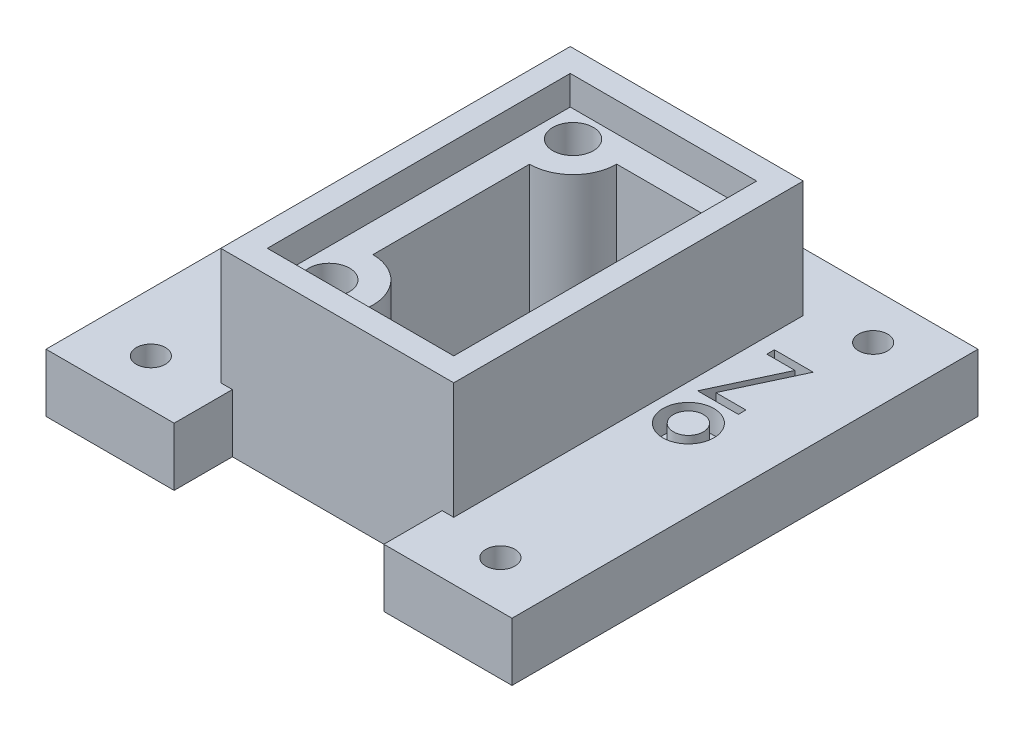
from build123d import *

# Parameters (mm, degrees)
BOSS_EXTRUDE1_DEPTH = 5
SKETCH2_W           = 20
SKETCH2_H           = 30
BOSS_EXTRUDE2_DEPTH = 10
SKETCH3_W           = 16
SKETCH3_H           = 26
CUT_EXTRUDE1_DEPTH  = 2.5
SKETCH4_R           = 1.741070667
SKETCH4_R_2         = 1.74917144
CUT_EXTRUDE2_DEPTH  = 12.5
CUT_EXTRUDE3_DEPTH  = 2.5
SKETCH10_R          = 2.187200611
SKETCH10_R_2        = 1.286018764
CUT_EXTRUDE7_DEPTH  = 2
SKETCH11_R          = 1.25
CUT_EXTRUDE8_DEPTH  = 5


with BuildPart() as part:
    # Sketch1 → Boss-Extrude1 (new body)
    with BuildSketch(Plane(origin=(0, 0, 0), x_dir=(1, 0, 0), z_dir=(0, 1, 0))):
        Polygon((-28.098710289, 18.79265625), (11.901289711, 18.79265625), (11.901289711, -21.20734375), (0.901289711, -21.20734375), (0.901289711, -16.20734375), (-17.098710289, -16.20734375), (-17.098710289, -21.20734375), (-28.098710289, -21.20734375), align=None)
    extrude(amount=BOSS_EXTRUDE1_DEPTH)

    # Sketch2 → Boss-Extrude2 (add)
    with BuildSketch(Plane(origin=(0, 5, 0), x_dir=(1, 0, 0), z_dir=(0, 1, 0))):
        with Locations((-8.098710289, -1.20734375)):
            Rectangle(SKETCH2_W, SKETCH2_H)
    extrude(amount=BOSS_EXTRUDE2_DEPTH)

    # Sketch3 → Cut-Extrude1 (cut)
    with BuildSketch(Plane(origin=(0, 15, 0), x_dir=(1, 0, 0), z_dir=(0, 1, 0))):
        with Locations((-8.098710289, -1.20734375)):
            Rectangle(SKETCH3_W, SKETCH3_H)
    extrude(amount=-CUT_EXTRUDE1_DEPTH, mode=Mode.SUBTRACT)

    # Sketch4 → Cut-Extrude2 (cut)
    with BuildSketch(Plane(origin=(0, 12.5, 0), x_dir=(1, 0, 0), z_dir=(0, 1, 0))):
        with Locations(Location((-13.598710289, 9.533726917, 0), (0, 0, 270))):
            Circle(SKETCH4_R)
        with Locations(Location((-13.598710289, -11.400038003, 0), (0, 0, 270))):
            Circle(SKETCH4_R_2)
        with BuildLine():
            Line((-9.857650278, 9.54265625), (-2.598710289, 9.54265625))
            Line((-2.598710289, 9.54265625), (-2.598710289, -11.70734375))
            Line((-2.598710289, -11.70734375), (-9.862154433, -11.70734375))
            ThreePointArc((-9.862154433, -11.70734375), (-10.841136317, -8.859945036), (-13.598710289, -7.650866563))
            Line((-13.598710289, -7.650866563), (-13.598710289, 5.79265625))
            ThreePointArc((-13.598710289, 5.79265625), (-10.950218737, 6.891549361), (-9.857650278, 9.54265625))
        make_face()
    extrude(amount=-CUT_EXTRUDE2_DEPTH, mode=Mode.SUBTRACT)

    # Sketch5 → Cut-Extrude3 (cut)
    with BuildSketch(Plane.XZ):
        Polygon((-11.013093596, 9.763602959), (-10.888707623, 12.821030221), (-13.474324315, 14.457465265), (-16.184326981, 13.036473046), (-16.308712955, 9.979045784), (-13.723096262, 8.34261074), align=None)
        Polygon((-10.5398219, -9.614567263), (-11.999256302, -6.925072038), (-15.05814469, -6.844231693), (-16.657598677, -9.452886572), (-15.198164275, -12.142381796), (-12.139275887, -12.223222142), align=None)
    extrude(amount=-CUT_EXTRUDE3_DEPTH, mode=Mode.SUBTRACT)

    # Sketch10 → Cut-Extrude7 (cut)
    # profile 1 of 6: a face of its own
    with BuildSketch(Plane(origin=(0, 5, 0), x_dir=(1, 0, 0), z_dir=(0, 1, 0))):
        with Locations(Location((4.971694187, 0.863959669, 0), (0, 0, 270))):
            Circle(SKETCH10_R)
        with Locations(Location((4.971694187, 0.863959669, 0), (0, 0, 270))):
            Circle(SKETCH10_R_2, mode=Mode.SUBTRACT)
    # profile 2 of 6: a face of its own
    with BuildSketch(Plane(origin=(0, 5, 0), x_dir=(1, 0, 0), z_dir=(0, 1, 0))):
        Polygon((-6.934780849, 18.55515625), (-6.441549178, 18.55515625), (-5.194636618, 16.607034255), (-3.947724058, 18.55515625), (-3.454492387, 18.55515625), (-4.947543769, 16.221607572), (-3.393434695, 13.79265625), (-3.886666366, 13.79265625), (-5.194636618, 15.836180889), (-6.50260687, 13.79265625), (-6.995838541, 13.79265625), (-5.44077544, 16.221607572), align=None)
    # profile 3 of 6: a face of its own
    with BuildSketch(Plane(origin=(0, 5, 0), x_dir=(1, 0, 0), z_dir=(0, 1, 0))):
        with BuildLine():
            add(Edge.make_bspline(
                [(-11.401511412, 18.039251811), (-11.391176898, 18.028213248), (-11.371535294, 18.007233539), (-11.350489172, 17.970347371), (-11.338990843, 17.930849446), (-11.340512779, 17.903871876), (-11.341271456, 17.890423686)],
                knots=[0, 0, 0, 0, 1.086383765, 2.064762959, 3.035293514, 4, 4, 4, 4], degree=3))
            add(Edge.make_bspline(
                [(-11.341271456, 17.890423686), (-11.345286126, 17.870413794), (-11.35451753, 17.824402693), (-11.407409924, 17.768867664), (-11.46486929, 17.715003045), (-11.503486765, 17.677881965), (-11.521991322, 17.660094445)],
                knots=[0, 0, 0, 0, 0.805786305, 1.852839402, 2.971132773, 4, 4, 4, 4], degree=3))
            Line((-11.521991322, 17.660094445), (-12.503548242, 16.719878671))
            Line((-12.503548242, 16.719878671), (-8.036342141, 16.719878671))
            add(Edge.make_bspline(
                [(-8.036342141, 16.719878671), (-8.020250186, 16.713443965), (-7.989700773, 16.70122814), (-7.951426601, 16.673751703), (-7.921719228, 16.640592241), (-7.91155186, 16.614013831), (-7.906412825, 16.600579936)],
                knots=[0, 0, 0, 0, 1.132039831, 2.149095914, 3.064471857, 4, 4, 4, 4], degree=3))
            add(Edge.make_bspline(
                [(-7.906412825, 16.600579936), (-7.904153928, 16.591959481), (-7.898584882, 16.570706755), (-7.898308734, 16.548697323), (-7.898144596, 16.535615278)],
                knots=[0, 0, 0, 0, 0.811232935, 2, 2, 2, 2], degree=3))
            add(Edge.make_bspline(
                [(-7.898144596, 16.535615278), (-7.900104637, 16.507845224), (-7.903792336, 16.455597545), (-7.939553018, 16.398803116), (-7.979274926, 16.368582892), (-8.016307766, 16.353207548), (-8.059114419, 16.343924657), (-8.089836832, 16.342600488), (-8.106031501, 16.341902481)],
                knots=[0, 0, 0, 0, 1.532586902, 2.883469612, 3.572224477, 4.289382852, 5.098284418, 6, 6, 6, 6], degree=3))
            Line((-8.106031501, 16.341902481), (-12.503548242, 16.341902481))
            Line((-12.503548242, 16.341902481), (-11.367257319, 15.181988046))
            add(Edge.make_bspline(
                [(-11.367257319, 15.181988046), (-11.359384504, 15.167352384), (-11.343512684, 15.137846471), (-11.342022481, 15.104366883), (-11.341271456, 15.087493998)],
                knots=[0, 0, 0, 0, 0.992049469, 2, 2, 2, 2], degree=3))
            add(Edge.make_bspline(
                [(-11.341271456, 15.087493998), (-11.342866453, 15.062624612), (-11.345806685, 15.016780178), (-11.379078345, 14.956711662), (-11.435197136, 14.91675613), (-11.480749877, 14.909518305), (-11.505454864, 14.905592957)],
                knots=[0, 0, 0, 0, 1.083364178, 1.99708253, 2.913741517, 4, 4, 4, 4], degree=3))
            add(Edge.make_bspline(
                [(-11.505454864, 14.905592957), (-11.521325004, 14.906890998), (-11.553006577, 14.90948228), (-11.599927674, 14.925946377), (-11.644669504, 14.953691951), (-11.67196162, 14.977985878), (-11.68617473, 14.9906376)],
                knots=[0, 0, 0, 0, 0.931180956, 1.858917334, 2.884973053, 4, 4, 4, 4], degree=3))
            Line((-11.68617473, 14.9906376), (-12.529534105, 15.816279341))
            Line((-12.529534105, 15.816279341), (-13.364625251, 16.370250695))
            add(Edge.make_bspline(
                [(-13.364625251, 16.370250695), (-13.379763836, 16.389915119), (-13.412320047, 16.432204351), (-13.415106318, 16.485722057), (-13.416596977, 16.514354117)],
                knots=[0, 0, 0, 0, 0.929996723, 2, 2, 2, 2], degree=3))
            add(Edge.make_bspline(
                [(-13.416596977, 16.514354117), (-13.408542134, 16.541337152), (-13.392591802, 16.594769402), (-13.350972773, 16.631839459), (-13.330371159, 16.650189311)],
                knots=[0, 0, 0, 0, 1.009990591, 2, 2, 2, 2], degree=3))
            Line((-13.330371159, 16.650189311), (-12.46102592, 17.228965353))
            Line((-12.46102592, 17.228965353), (-11.61648537, 18.054607094))
            add(Edge.make_bspline(
                [(-11.61648537, 18.054607094), (-11.60385435, 18.062470279), (-11.577506918, 18.078872338), (-11.546435342, 18.080003879), (-11.530259551, 18.080592957)],
                knots=[0, 0, 0, 0, 0.958804667, 2, 2, 2, 2], degree=3))
            add(Edge.make_bspline(
                [(-11.530259551, 18.080592957), (-11.507721042, 18.078590928), (-11.46172399, 18.074505148), (-11.421848137, 18.051158583), (-11.401511412, 18.039251811)],
                knots=[0, 0, 0, 0, 0.979997969, 2, 2, 2, 2], degree=3))
        make_face()
    # profile 4 of 6: a face of its own
    with BuildSketch(Plane(origin=(0, 5, 0), x_dir=(1, 0, 0), z_dir=(0, 1, 0))):
        Polygon((-22.941002403, -3.078624451), (-22.288448317, -3.078624451), (-20.61953806, -0.350108826), (-18.953171875, -3.078624451), (-18.300617788, -3.078624451), (-20.335874198, 0.252835886), (-20.335874198, 3.271375549), (-20.905745993, 3.271375549), (-20.905745993, 0.252835886), align=None)
    # profile 5 of 6: a face of its own
    with BuildSketch(Plane(origin=(0, 5, 0), x_dir=(1, 0, 0), z_dir=(0, 1, 0))):
        with BuildLine():
            Line((-24.564686436, 2.417475822), (-24.545787627, 2.331250003))
            Line((-24.545787627, 2.331250003), (-24.545787627, -2.056817333))
            Line((-24.545787627, -2.056817333), (-23.416583758, -0.911077005))
            add(Edge.make_bspline(
                [(-23.416583758, -0.911077005), (-23.404356652, -0.903213688), (-23.378861833, -0.886817833), (-23.348513705, -0.885682157), (-23.33272029, -0.885091142)],
                knots=[0, 0, 0, 0, 0.9591836, 2, 2, 2, 2], degree=3))
            add(Edge.make_bspline(
                [(-23.33272029, -0.885091142), (-23.314281924, -0.887596019), (-23.273490267, -0.893137619), (-23.215155022, -0.926839086), (-23.159303645, -0.98221648), (-23.146023553, -1.035367972), (-23.139007493, -1.063448657)],
                knots=[0, 0, 0, 0, 0.780587553, 1.726913212, 2.799096073, 4, 4, 4, 4], degree=3))
            add(Edge.make_bspline(
                [(-23.139007493, -1.063448657), (-23.142781192, -1.086622741), (-23.151121599, -1.137840733), (-23.204848501, -1.202178987), (-23.26599129, -1.263443955), (-23.307523347, -1.305915484), (-23.327995588, -1.326850815)],
                knots=[0, 0, 0, 0, 0.837433221, 1.85084549, 2.940625369, 4, 4, 4, 4], degree=3))
            Line((-23.327995588, -1.326850815), (-24.060324457, -2.056817333))
            Line((-24.060324457, -2.056817333), (-24.628469918, -2.888364952))
            add(Edge.make_bspline(
                [(-24.628469918, -2.888364952), (-24.64876248, -2.90076647), (-24.688742066, -2.925199441), (-24.735415821, -2.929010571), (-24.758399234, -2.930887273)],
                knots=[0, 0, 0, 0, 1.015146165, 2, 2, 2, 2], degree=3))
            Line((-24.758399234, -2.930887273), (-24.818639189, -2.930887273))
            add(Edge.make_bspline(
                [(-24.818639189, -2.930887273), (-24.828356459, -2.925755597), (-24.851931248, -2.913305785), (-24.885489948, -2.879171721), (-24.924248519, -2.830082266), (-24.950446838, -2.790957032), (-24.965104963, -2.769066217)],
                knots=[0, 0, 0, 0, 0.594680612, 1.442737441, 2.569195468, 4, 4, 4, 4], degree=3))
            Line((-24.965104963, -2.769066217), (-25.490728103, -2.006026782))
            Line((-25.490728103, -2.006026782), (-26.342355707, -1.156761529))
            add(Edge.make_bspline(
                [(-26.342355707, -1.156761529), (-26.347292725, -1.141931951), (-26.355636065, -1.116870627), (-26.358786939, -1.090678523), (-26.360073341, -1.079985116)],
                knots=[0, 0, 0, 0, 1.183463243, 2, 2, 2, 2], degree=3))
            add(Edge.make_bspline(
                [(-26.360073341, -1.079985116), (-26.359048777, -1.064921423), (-26.356885957, -1.033122473), (-26.347365936, -1.002688917), (-26.342355707, -0.986672244)],
                knots=[0, 0, 0, 0, 0.947433318, 2, 2, 2, 2], degree=3))
            add(Edge.make_bspline(
                [(-26.342355707, -0.986672244), (-26.332104417, -0.972139859), (-26.312520677, -0.944377652), (-26.271396042, -0.915743031), (-26.226302859, -0.89627663), (-26.193741442, -0.894350312), (-26.176991124, -0.893359372)],
                knots=[0, 0, 0, 0, 1.068155181, 2.04056985, 2.992025482, 4, 4, 4, 4], degree=3))
            add(Edge.make_bspline(
                [(-26.176991124, -0.893359372), (-26.151213721, -0.896202818), (-26.098647776, -0.902001246), (-26.058216767, -0.936180811), (-26.037612403, -0.953599327)],
                knots=[0, 0, 0, 0, 0.98076435, 2, 2, 2, 2], degree=3))
            Line((-26.037612403, -0.953599327), (-24.923763817, -2.056817333))
            Line((-24.923763817, -2.056817333), (-24.923763817, 2.3749535))
            add(Edge.make_bspline(
                [(-24.923763817, 2.3749535), (-24.917311192, 2.389220296), (-24.905326533, 2.415718452), (-24.885173638, 2.451273429), (-24.859419469, 2.47557905), (-24.824609932, 2.495728529), (-24.781020749, 2.508855252), (-24.746262666, 2.510979221), (-24.730051019, 2.51196987)],
                knots=[0, 0, 0, 0, 1.101707259, 2.046234615, 2.848742994, 3.555887495, 4.860032424, 6, 6, 6, 6], degree=3))
            add(Edge.make_bspline(
                [(-24.730051019, 2.51196987), (-24.710189826, 2.511069), (-24.673443437, 2.509402246), (-24.623812972, 2.49146448), (-24.58509219, 2.460547427), (-24.571559971, 2.43198419), (-24.564686436, 2.417475822)],
                knots=[0, 0, 0, 0, 1.16633933, 2.157914548, 3.064333863, 4, 4, 4, 4], degree=3))
        make_face()
    # profile 6 of 6: a face of its own
    with BuildSketch(Plane(origin=(0, 5, 0), x_dir=(1, 0, 0), z_dir=(0, 1, 0))):
        Polygon((3.203694161, 9.359973523), (3.203694161, 10.011255574), (6.541514674, 10.011255574), (3.877872847, 4.312537626), (6.460104417, 4.312537626), (6.460104417, 3.661255574), (2.959463392, 3.661255574), (5.623105219, 9.359973523), align=None)
    extrude(amount=-CUT_EXTRUDE7_DEPTH, mode=Mode.SUBTRACT)

    # Sketch11 → Cut-Extrude8 (cut)
    with BuildSketch(Plane(origin=(0, 5, 0), x_dir=(1, 0, 0), z_dir=(0, 1, 0))):
        with Locations(Location((-23.098710289, 14.79265625, 0), (0, 0, 270))):
            Circle(SKETCH11_R)
        with Locations(Location((6.901289711, 14.79265625, 0), (0, 0, 270))):
            Circle(SKETCH11_R)
        with Locations(Location((6.901289711, -17.20734375, 0), (0, 0, 270))):
            Circle(SKETCH11_R)
        with Locations(Location((-23.098710289, -17.20734375, 0), (0, 0, 270))):
            Circle(SKETCH11_R)
    extrude(amount=-CUT_EXTRUDE8_DEPTH, mode=Mode.SUBTRACT)


solid = part.part
